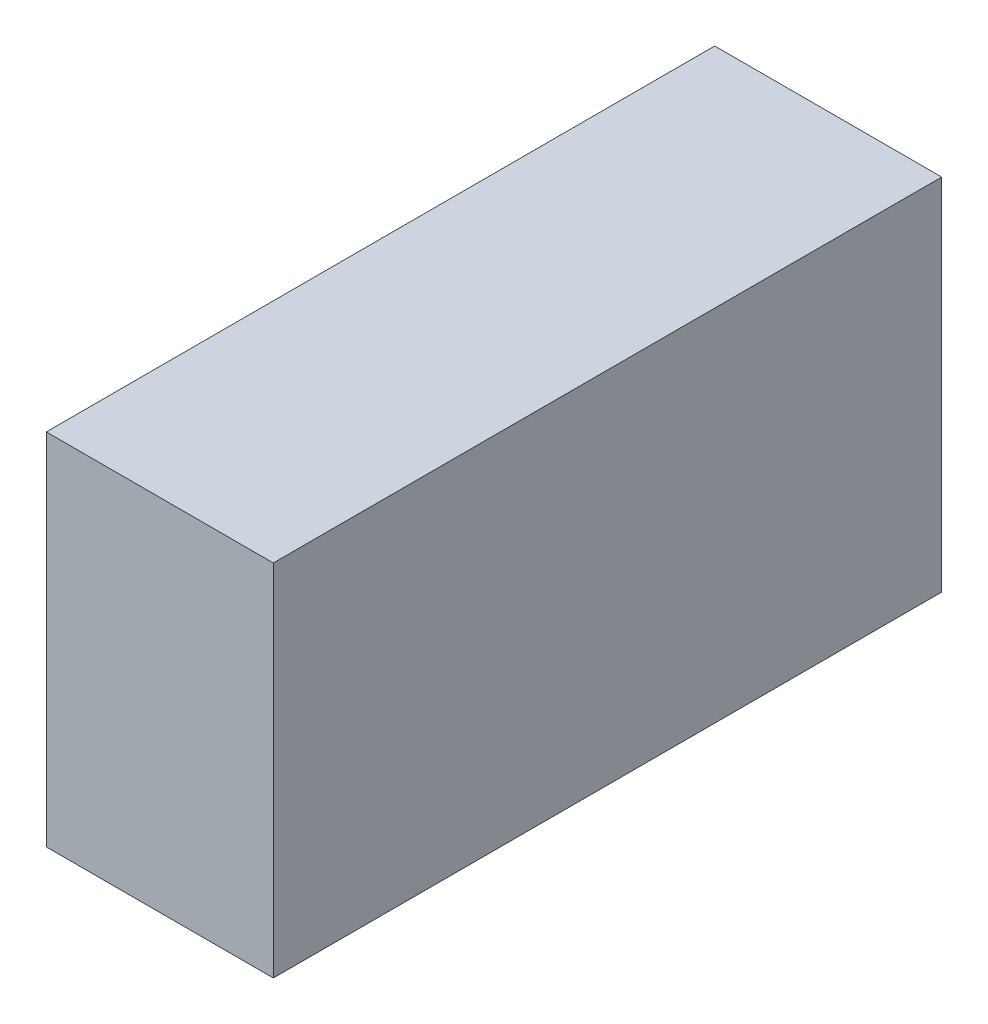
from build123d import *

# Parameters (mm, degrees)
SKETCH_1_W      = 36
SKETCH_1_H      = 57
EXTRUDE_1_DEPTH = 106


with BuildPart() as part:
    # 草圖1 → 填料-伸長1 (new body)
    with BuildSketch(Plane.XY):
        Rectangle(SKETCH_1_W, SKETCH_1_H)
    extrude(amount=EXTRUDE_1_DEPTH)


solid = part.part
